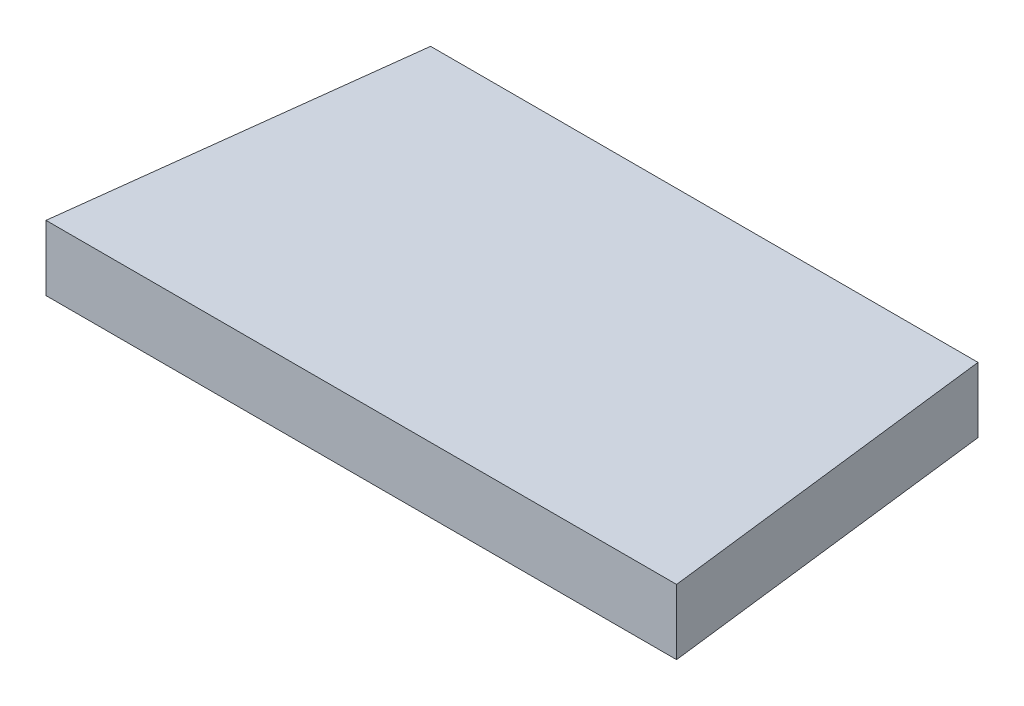
from build123d import *

# Parameters (mm, degrees)
SALIENTE_EXTRUIR1_DEPTH = 30
CORTAR_EXTRUIR2_DEPTH   = 90
CROQUIS5_W              = 20
CROQUIS5_H              = 2
SALIENTE_EXTRUIR2_DEPTH = 3
CHAFL_N1_SIZE           = 15
CHAFL_N1_SIZE2          = 4.585960222
CHAFL_N2_SIZE           = 15
CHAFL_N2_SIZE2          = 4.585960222
CHAFL_N3_SIZE           = 15
CHAFL_N3_SIZE2          = 4.873795443
SALIENTE_EXTRUIR3_DEPTH = 5
CROQUIS7_W              = 20
CROQUIS7_H              = 2
CORTAR_EXTRUIR3_DEPTH   = 65
CROQUIS8_W              = 69.078643268
CROQUIS8_H              = 63.245130673
CORTAR_EXTRUIR4_DEPTH   = 5


with BuildPart() as part:
    # Croquis2 → Saliente-Extruir1 (new body)
    with BuildSketch(Plane(origin=(0, 0, 0), x_dir=(1, 0, 0), z_dir=(0, 1, 0))):
        Polygon((0, 0), (4.293050572, 35.408576274), (-0.206949428, 35.33296049), (-14, 0), align=None)
        Polygon((24.793050572, 35.408576274), (4.293050572, 35.408576274), (3.44434788, 28.408576274), (24.793050572, 28.408576274), align=None)
        Polygon((45.293050572, 35.408576274), (24.793050572, 35.408576274), (24.793050572, 28.408576274), (46.141753264, 28.408576274), align=None)
        Polygon((49.793050572, 35.33296049), (63.586101144, 0), (49.586101144, 0), (45.293050572, 35.408576274), align=None)
    extrude(amount=SALIENTE_EXTRUIR1_DEPTH)

    # Croquis4 → Cortar-Extruir2 (cut, symmetric)
    with BuildSketch(Plane(origin=(0, 0, 0), x_dir=(0, 0, -1), z_dir=(1, 0, 0))):
        Polygon((0, 0), (5, 0), (5, 30), (-4.90661078, 30), (-4.90661078, 0), align=None)
    extrude(amount=CORTAR_EXTRUIR2_DEPTH, both=True, mode=Mode.SUBTRACT)

    # Croquis5 → Saliente-Extruir2 (add)
    with BuildSketch(Plane(origin=(0, 0, 0), x_dir=(-1, 0, 0), z_dir=(0, -1, 0))):
        with Locations((-24.793050572, 32.408576274)):
            Rectangle(CROQUIS5_W, CROQUIS5_H)
    extrude(amount=SALIENTE_EXTRUIR2_DEPTH)

    # Chaflán1
    chafl_n1_edges = [part.edges().sort_by_distance(p)[0] for p in [
        (2.025282044, 30, -16.704288137),
    ]]
    chafl_n1_side = [part.faces().sort_by_distance(p)[0] for p in [
        (2.025282044, 15, -16.704288137),
    ]]
    chamfer(chafl_n1_edges, length=CHAFL_N1_SIZE, length2=CHAFL_N1_SIZE2, reference=chafl_n1_side[0])

    # Chaflán2
    chafl_n2_edges = [part.edges().sort_by_distance(p)[0] for p in [
        (47.5608191, 30, -16.704288137),
    ]]
    chafl_n2_side = [part.faces().sort_by_distance(p)[0] for p in [
        (47.5608191, 15, -16.704288137),
    ]]
    chamfer(chafl_n2_edges, length=CHAFL_N2_SIZE, length2=CHAFL_N2_SIZE2, reference=chafl_n2_side[0])

    # Chaflán3
    chafl_n3_edges = [part.edges().sort_by_distance(p)[0] for p in [
        (24.793050572, 30, -28.408576274),
    ]]
    chafl_n3_side = [part.faces().sort_by_distance(p)[0] for p in [
        (24.793050572, 15.5132008, -28.408576274),
    ]]
    chamfer(chafl_n3_edges, length=CHAFL_N3_SIZE, length2=CHAFL_N3_SIZE2, reference=chafl_n3_side[0])

    # Croquis7 → Cortar-Extruir3 (cut)
    # profile 1 of 3: a face of its own
    with BuildSketch(Plane.XZ):
        Polygon((0.606216209, -38.306494664), (49.793050572, -38.306494664), (49.793050572, -35.33296049), (45.293050572, -35.408576274), (4.293050572, -35.408576274), (-0.206949428, -35.33296049), align=None)
    # profile 2 of 3: a face of its own
    with BuildSketch(Plane.XZ):
        Polygon((-0.206949428, -35.33296049), (49.793050572, -35.33296049), (61.634233768, -5), (48.979884935, -5), (46.141753264, -28.408576274), (3.44434788, -28.408576274), (0.606216209, -5), (-12.048132625, -5), align=None)
        with Locations((24.793050572, -32.408576274)):
            Rectangle(CROQUIS7_W, CROQUIS7_H, mode=Mode.SUBTRACT)
    # profile 3 of 3: a face of its own
    with BuildSketch(Plane.XZ):
        with Locations((24.793050572, -32.408576274)):
            Rectangle(CROQUIS7_W, CROQUIS7_H)
    extrude(amount=-CORTAR_EXTRUIR3_DEPTH, mode=Mode.SUBTRACT)


with BuildPart() as body_2:
    # Croquis6 → Saliente-Extruir3 (new body)
    with BuildSketch(Plane.XZ):
        Polygon((0.608725752, -1.697385274), (3.798779842, -28.008576274), (45.787321302, -28.008576274), (48.977375392, -1.697385274), align=None)
    extrude(amount=-SALIENTE_EXTRUIR3_DEPTH)


with BuildPart() as cortar_extruir3_piece_1:
    # of the separate pieces the step leaves, piece 1, a body of its own (cortar_extruir3_pieces)
    add(part.part.solids().sort_by_distance((14.793050572, 0, -31.408576274))[0])


with BuildPart() as cortar_extruir3_piece_2:
    # of the separate pieces the step leaves, piece 2, a body of its own (cortar_extruir3_pieces)
    add(part.part.solids().sort_by_distance((4.293050572, 0, -35.408576274))[0])


with BuildPart() as cortar_extruir4_tool:
    # Croquis8 → Cortar-Extruir4 (new body)
    with BuildSketch(Plane(origin=(0, 0, -35.408576274), x_dir=(-1, 0, 0), z_dir=(0, 0, -1))):
        with Locations((-28.687723689, 10.469966138)):
            Rectangle(CROQUIS8_W, CROQUIS8_H)
    extrude(amount=-CORTAR_EXTRUIR4_DEPTH)


with BuildPart() as cortar_extruir3_piece_1_1:
    add(cortar_extruir3_piece_1.part)

    # Cortar-Extruir4: cut by cortar_extruir4_tool
    add(cortar_extruir4_tool.part, mode=Mode.SUBTRACT)


with BuildPart() as cortar_extruir3_piece_2_1:
    add(cortar_extruir3_piece_2.part)

    # Cortar-Extruir4: cut by cortar_extruir4_tool
    add(cortar_extruir4_tool.part, mode=Mode.SUBTRACT)


solid = body_2.part
